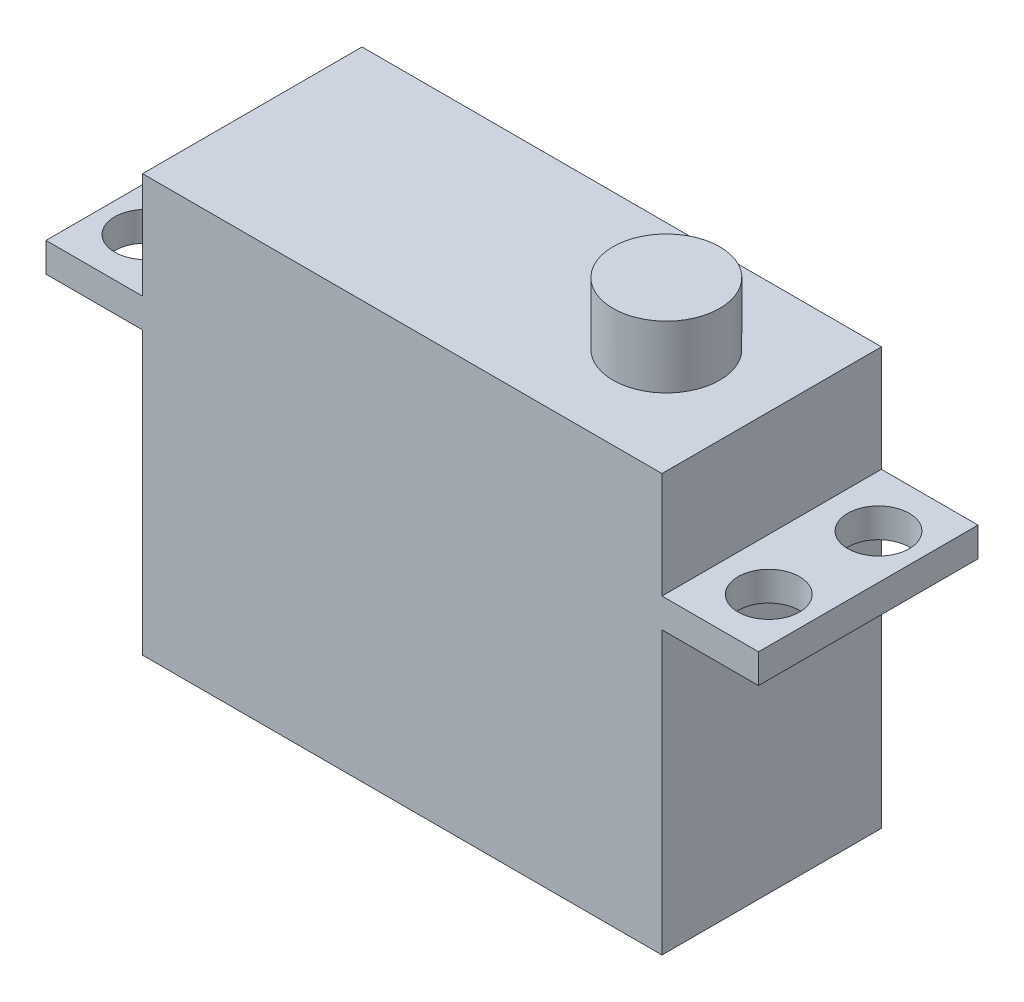
from build123d import *

# Parameters (mm, degrees)
SKETCH_1_W      = 35.5
SKETCH_1_H      = 15
EXTRUDE_1_DEPTH = 19.25
SKETCH_2_W      = 35.5
SKETCH_2_H      = 15
SKETCH_2_W_2    = 6.6
SKETCH_2_R      = 2.1
EXTRUDE_2_DEPTH = 2
SKETCH_3_W      = 35.5
SKETCH_3_H      = 15
EXTRUDE_3_DEPTH = 7.25
SKETCH_4_R      = 3.649626988
EXTRUDE_4_DEPTH = 4.25


with BuildPart() as part:
    # 草图1 → 凸台-拉伸1 (new body)
    with BuildSketch(Plane(origin=(0, 0, 0), x_dir=(1, 0, 0), z_dir=(0, 1, 0))):
        with Locations((17.75, 7.5)):
            Rectangle(SKETCH_1_W, SKETCH_1_H)
    extrude(amount=EXTRUDE_1_DEPTH)

    # 草图2 → 凸台-拉伸2 (add)
    # profile 1 of 3: a face of its own
    with BuildSketch(Plane(origin=(0, 19.25, 0), x_dir=(1, 0, 0), z_dir=(0, 1, 0))):
        with Locations((17.75, 7.5)):
            Rectangle(SKETCH_2_W, SKETCH_2_H)
    # profile 2 of 3: a face of its own
    with BuildSketch(Plane(origin=(0, 19.25, 0), x_dir=(1, 0, 0), z_dir=(0, 1, 0))):
        with Locations((38.8, 7.5)):
            Rectangle(SKETCH_2_W_2, SKETCH_2_H)
        with Locations(Location((39.05, 3.75, 0), (0, 0, 270))):
            Circle(SKETCH_2_R, mode=Mode.SUBTRACT)
        with Locations(Location((39.05, 11.25, 0), (0, 0, 270))):
            Circle(SKETCH_2_R, mode=Mode.SUBTRACT)
    # profile 3 of 3: a face of its own
    with BuildSketch(Plane(origin=(0, 19.25, 0), x_dir=(1, 0, 0), z_dir=(0, 1, 0))):
        with Locations((-3.3, 7.5)):
            Rectangle(SKETCH_2_W_2, SKETCH_2_H)
        with Locations(Location((-3.55, 3.75, 0), (0, 0, 270))):
            Circle(SKETCH_2_R, mode=Mode.SUBTRACT)
        with Locations(Location((-3.55, 11.25, 0), (0, 0, 270))):
            Circle(SKETCH_2_R, mode=Mode.SUBTRACT)
    extrude(amount=EXTRUDE_2_DEPTH)

    # 草图3 → 凸台-拉伸3 (add)
    with BuildSketch(Plane(origin=(0, 21.25, 0), x_dir=(1, 0, 0), z_dir=(0, 1, 0))):
        with Locations((17.75, 7.5)):
            Rectangle(SKETCH_3_W, SKETCH_3_H)
    extrude(amount=EXTRUDE_3_DEPTH)

    # 草图4 → 凸台-拉伸4 (add)
    with BuildSketch(Plane(origin=(0, 28.5, 0), x_dir=(1, 0, 0), z_dir=(0, 1, 0))):
        with Locations(Location((28.3, 7.5, 0), (0, 0, 90))):
            Circle(SKETCH_4_R)
    extrude(amount=EXTRUDE_4_DEPTH)


solid = part.part
